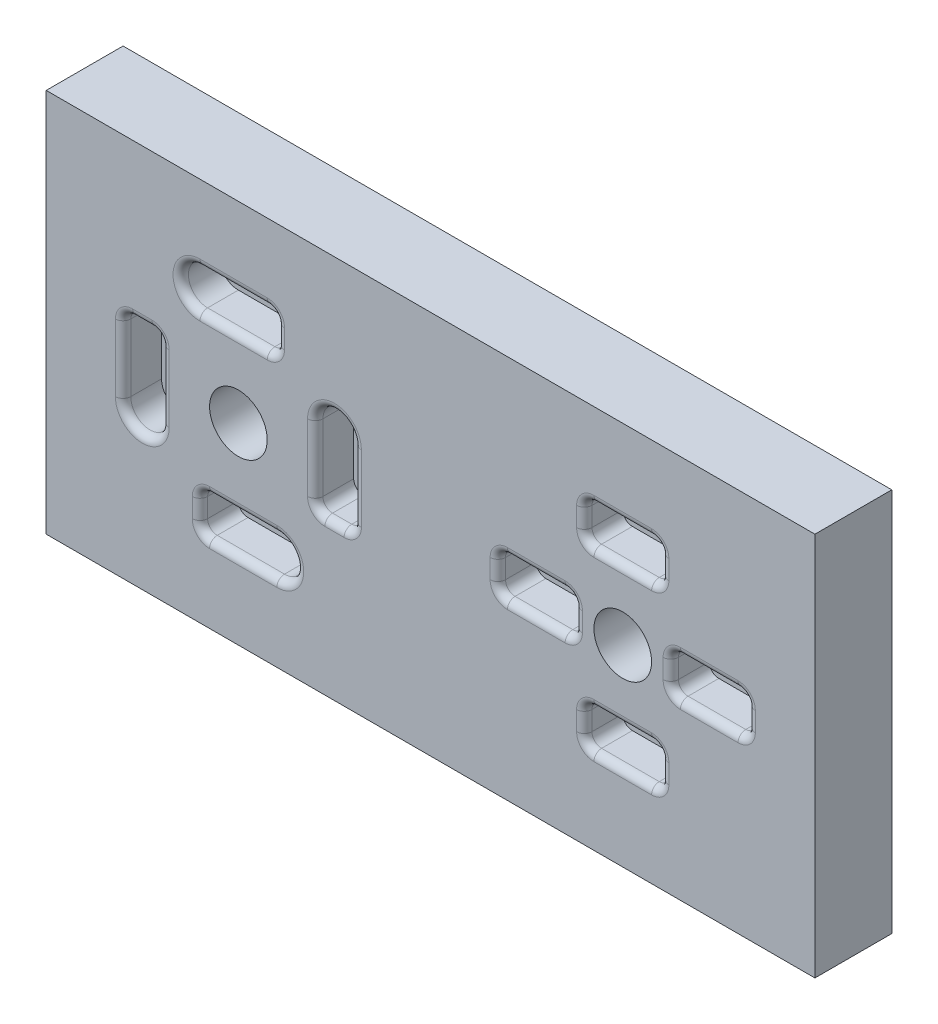
from build123d import *

# Parameters (mm, degrees)
SKETCH1_W          = 254
SKETCH1_H          = 127
EXTRUDE1_DEPTH     = 25.4
SKETCH2_R          = 9.525
CUT_EXTRUDE1_DEPTH = 19.05
CUT_EXTRUDE2_DEPTH = 12.7
FILLET2_R          = 2.54
CUT_EXTRUDE3_DEPTH = 12.7
FILLET3_R          = 2.54


with BuildPart() as part:
    # Sketch1 → Extrude1 (new body)
    with BuildSketch(Plane.XY):
        with Locations((127, 63.5)):
            Rectangle(SKETCH1_W, SKETCH1_H)
    extrude(amount=EXTRUDE1_DEPTH)

    # Sketch2 → Cut-Extrude1 (cut)
    with BuildSketch(Plane.XY.offset(25.4)):
        with Locations((63.5, 63.5)):
            Circle(SKETCH2_R)
        with Locations((190.5, 63.5)):
            Circle(SKETCH2_R)
    extrude(amount=-CUT_EXTRUDE1_DEPTH, mode=Mode.SUBTRACT)

    # Sketch3 → Cut-Extrude2 (cut)
    with BuildSketch(Plane.XY.offset(25.4)):
        with BuildLine():
            Line((50.8, 34.925), (50.8, 28.575))
            ThreePointArc((50.8, 28.575), (51.72993597, 26.32993597), (53.975, 25.4))
            Line((53.975, 25.4), (76.2, 25.4))
            ThreePointArc((76.2, 25.4), (82.55, 31.75), (76.2, 38.1))
            Line((76.2, 38.1), (53.975, 38.1))
            ThreePointArc((53.975, 38.1), (51.72993597, 37.17006403), (50.8, 34.925))
        make_face()
        with BuildLine():
            Line((101.6, 53.975), (101.6, 76.2))
            ThreePointArc((101.6, 76.2), (95.25, 82.55), (88.9, 76.2))
            Line((88.9, 76.2), (88.9, 53.975))
            ThreePointArc((88.9, 53.975), (89.82993597, 51.72993597), (92.075, 50.8))
            Line((92.075, 50.8), (98.425, 50.8))
            ThreePointArc((98.425, 50.8), (100.67006403, 51.72993597), (101.6, 53.975))
        make_face()
        with BuildLine():
            Line((73.025, 101.6), (50.8, 101.6))
            ThreePointArc((50.8, 101.6), (44.45, 95.25), (50.8, 88.9))
            Line((50.8, 88.9), (73.025, 88.9))
            ThreePointArc((73.025, 88.9), (75.27006403, 89.82993597), (76.2, 92.075))
            Line((76.2, 92.075), (76.2, 98.425))
            ThreePointArc((76.2, 98.425), (75.27006403, 100.67006403), (73.025, 101.6))
        make_face()
        with BuildLine():
            Line((25.4, 73.025), (25.4, 50.8))
            ThreePointArc((25.4, 50.8), (31.75, 44.45), (38.1, 50.8))
            Line((38.1, 50.8), (38.1, 73.025))
            ThreePointArc((38.1, 73.025), (37.17006403, 75.27006403), (34.925, 76.2))
            Line((34.925, 76.2), (28.575, 76.2))
            ThreePointArc((28.575, 76.2), (26.32993597, 75.27006403), (25.4, 73.025))
        make_face()
    extrude(amount=-CUT_EXTRUDE2_DEPTH, mode=Mode.SUBTRACT)

    # Fillet2
    fillet2_edges = [part.edges().sort_by_distance(p)[0] for p in [
        (50.8, 31.75, 25.4),
        (51.72993597, 26.32993597, 25.4),
        (65.0875, 25.4, 25.4),
        (82.55, 31.75, 25.4),
        (65.0875, 38.1, 25.4),
        (51.72993597, 37.17006403, 25.4),
        (25.4, 61.9125, 25.4),
        (31.75, 44.45, 25.4),
        (38.1, 61.9125, 25.4),
        (37.17006403, 75.27006403, 25.4),
        (31.75, 76.2, 25.4),
        (26.32993597, 75.27006403, 25.4),
        (101.6, 65.0875, 25.4),
        (95.25, 82.55, 25.4),
        (88.9, 65.0875, 25.4),
        (89.82993597, 51.72993597, 25.4),
        (95.25, 50.8, 25.4),
        (100.67006403, 51.72993597, 25.4),
        (75.27006403, 100.67006403, 25.4),
        (61.9125, 101.6, 25.4),
        (44.45, 95.25, 25.4),
        (61.9125, 88.9, 25.4),
        (75.27006403, 89.82993597, 25.4),
        (76.2, 95.25, 25.4),
    ]]
    fillet(fillet2_edges, radius=FILLET2_R)

    # Sketch4 → Cut-Extrude3 (cut)
    with BuildSketch(Plane.XY.offset(25.4)):
        with BuildLine():
            Line((203.2, 37.465), (203.2, 31.115))
            ThreePointArc((203.2, 31.115), (202.27006403, 28.86993597), (200.025, 27.94))
            Line((200.025, 27.94), (180.975, 27.94))
            ThreePointArc((180.975, 27.94), (178.72993597, 28.86993597), (177.8, 31.115))
            Line((177.8, 31.115), (177.8, 37.465))
            ThreePointArc((177.8, 37.465), (178.72993597, 39.71006403), (180.975, 40.64))
            Line((180.975, 40.64), (200.025, 40.64))
            ThreePointArc((200.025, 40.64), (202.27006403, 39.71006403), (203.2, 37.465))
        make_face()
        with BuildLine():
            Line((180.975, 99.06), (200.025, 99.06))
            ThreePointArc((200.025, 99.06), (202.27006403, 98.13006403), (203.2, 95.885))
            Line((203.2, 95.885), (203.2, 89.535))
            ThreePointArc((203.2, 89.535), (202.27006403, 87.28993597), (200.025, 86.36))
            Line((200.025, 86.36), (180.975, 86.36))
            ThreePointArc((180.975, 86.36), (178.72993597, 87.28993597), (177.8, 89.535))
            Line((177.8, 89.535), (177.8, 95.885))
            ThreePointArc((177.8, 95.885), (178.72993597, 98.13006403), (180.975, 99.06))
        make_face()
        with BuildLine():
            Line((209.55, 69.85), (228.6, 69.85))
            ThreePointArc((228.6, 69.85), (230.84506403, 68.92006403), (231.775, 66.675))
            Line((231.775, 66.675), (231.775, 60.325))
            ThreePointArc((231.775, 60.325), (230.84506403, 58.07993597), (228.6, 57.15))
            Line((228.6, 57.15), (209.55, 57.15))
            ThreePointArc((209.55, 57.15), (207.30493597, 58.07993597), (206.375, 60.325))
            Line((206.375, 60.325), (206.375, 66.675))
            ThreePointArc((206.375, 66.675), (207.30493597, 68.92006403), (209.55, 69.85))
        make_face()
        with BuildLine():
            Line((149.225, 66.675), (149.225, 60.325))
            ThreePointArc((149.225, 60.325), (150.15493597, 58.07993597), (152.4, 57.15))
            Line((152.4, 57.15), (171.45, 57.15))
            ThreePointArc((171.45, 57.15), (173.69506403, 58.07993597), (174.625, 60.325))
            Line((174.625, 60.325), (174.625, 66.675))
            ThreePointArc((174.625, 66.675), (173.69506403, 68.92006403), (171.45, 69.85))
            Line((171.45, 69.85), (152.4, 69.85))
            ThreePointArc((152.4, 69.85), (150.15493597, 68.92006403), (149.225, 66.675))
        make_face()
    extrude(amount=-CUT_EXTRUDE3_DEPTH, mode=Mode.SUBTRACT)

    # Fillet3
    fillet3_edges = [part.edges().sort_by_distance(p)[0] for p in [
        (202.27006403, 39.71006403, 25.4),
        (190.5, 40.64, 25.4),
        (178.72993597, 39.71006403, 25.4),
        (177.8, 34.29, 25.4),
        (178.72993597, 28.86993597, 25.4),
        (190.5, 27.94, 25.4),
        (202.27006403, 28.86993597, 25.4),
        (203.2, 34.29, 25.4),
        (149.225, 63.5, 25.4),
        (150.15493597, 58.07993597, 25.4),
        (161.925, 57.15, 25.4),
        (173.69506403, 58.07993597, 25.4),
        (174.625, 63.5, 25.4),
        (173.69506403, 68.92006403, 25.4),
        (161.925, 69.85, 25.4),
        (150.15493597, 68.92006403, 25.4),
        (207.30493597, 68.92006403, 25.4),
        (206.375, 63.5, 25.4),
        (207.30493597, 58.07993597, 25.4),
        (219.075, 57.15, 25.4),
        (230.84506403, 58.07993597, 25.4),
        (231.775, 63.5, 25.4),
        (230.84506403, 68.92006403, 25.4),
        (219.075, 69.85, 25.4),
        (178.72993597, 98.13006403, 25.4),
        (177.8, 92.71, 25.4),
        (178.72993597, 87.28993597, 25.4),
        (190.5, 86.36, 25.4),
        (202.27006403, 87.28993597, 25.4),
        (203.2, 92.71, 25.4),
        (202.27006403, 98.13006403, 25.4),
        (190.5, 99.06, 25.4),
    ]]
    fillet(fillet3_edges, radius=FILLET3_R)


solid = part.part
